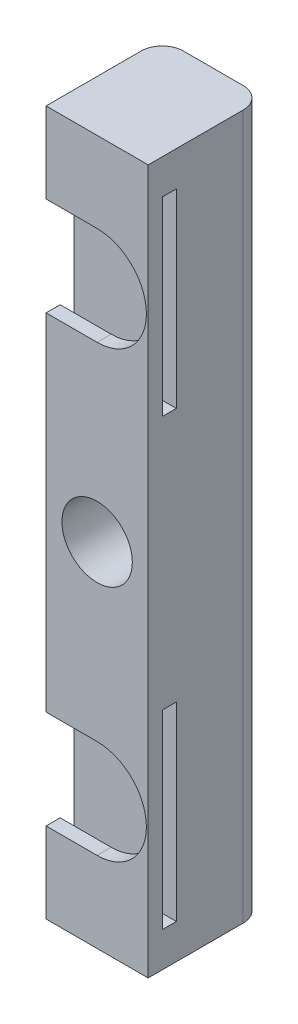
from build123d import *

# Parameters (mm, degrees)
SKETCH7_W           = 100
SKETCH7_H           = 14.5
BOSS_EXTRUDE1_DEPTH = 16.5
SKETCH8_R           = 5
CUT_EXTRUDE2_DEPTH  = 13
CUT_EXTRUDE3_START  = -2
SKETCH9_W           = 27
SKETCH9_H           = 27
CUT_EXTRUDE3_DEPTH  = 2
CUT_EXTRUDE4_DEPTH  = 2
FILLET1_R           = 3
FILLET2_R           = 3


with BuildPart() as part:
    # Sketch7 → Boss-Extrude1 (new body)
    with BuildSketch(Plane(origin=(0, 0, 0), x_dir=(0, 1, 0), z_dir=(0, 0, 1))):
        Rectangle(SKETCH7_W, SKETCH7_H)
    extrude(amount=BOSS_EXTRUDE1_DEPTH)

    # Sketch8 → Cut-Extrude2 (cut)
    with BuildSketch(Plane(origin=(0, 0, 16.5), x_dir=(0, -1, 0), z_dir=(0, 0, 1))):
        with Locations(Location((0, 0, 0), (0, 0, 90))):
            Circle(SKETCH8_R)
    extrude(amount=-CUT_EXTRUDE2_DEPTH, mode=Mode.SUBTRACT)

    # Sketch9 → Cut-Extrude3 (cut)
    with BuildSketch(Plane.XY.offset(16.5).offset(CUT_EXTRUDE3_START)):
        with Locations((0, -31.55)):
            Rectangle(SKETCH9_W, SKETCH9_H)
    cut_extrude3 = extrude(amount=-CUT_EXTRUDE3_DEPTH, mode=Mode.SUBTRACT)

    # Sketch10 → Cut-Extrude4 (cut)
    with BuildSketch(Plane.XY.offset(16.5)):
        with BuildLine():
            Line((0, -24.55), (-7.25, -24.55))
            Line((-7.25, -24.55), (-7.25, -38.55))
            Line((-7.25, -38.55), (0, -38.55))
            ThreePointArc((0, -38.55), (7, -31.55), (0, -24.55))
        make_face()
    cut_extrude4 = extrude(amount=-CUT_EXTRUDE4_DEPTH, mode=Mode.SUBTRACT)

    # Mirror1: Cut-Extrude3 across plane
    add(cut_extrude3.mirror(Plane.ZX), mode=Mode.SUBTRACT)

    # Mirror2: Cut-Extrude4 across plane
    add(cut_extrude4.mirror(Plane.ZX), mode=Mode.SUBTRACT)

    # Fillet1
    fillet1_edges = [part.edges().sort_by_distance(p)[0] for p in [
        (-7.25, 0, 0),
    ]]
    fillet(fillet1_edges, radius=FILLET1_R)

    # Fillet2
    fillet2_edges = [part.edges().sort_by_distance(p)[0] for p in [
        (7.25, 0, 0),
    ]]
    fillet(fillet2_edges, radius=FILLET2_R)


solid = part.part
